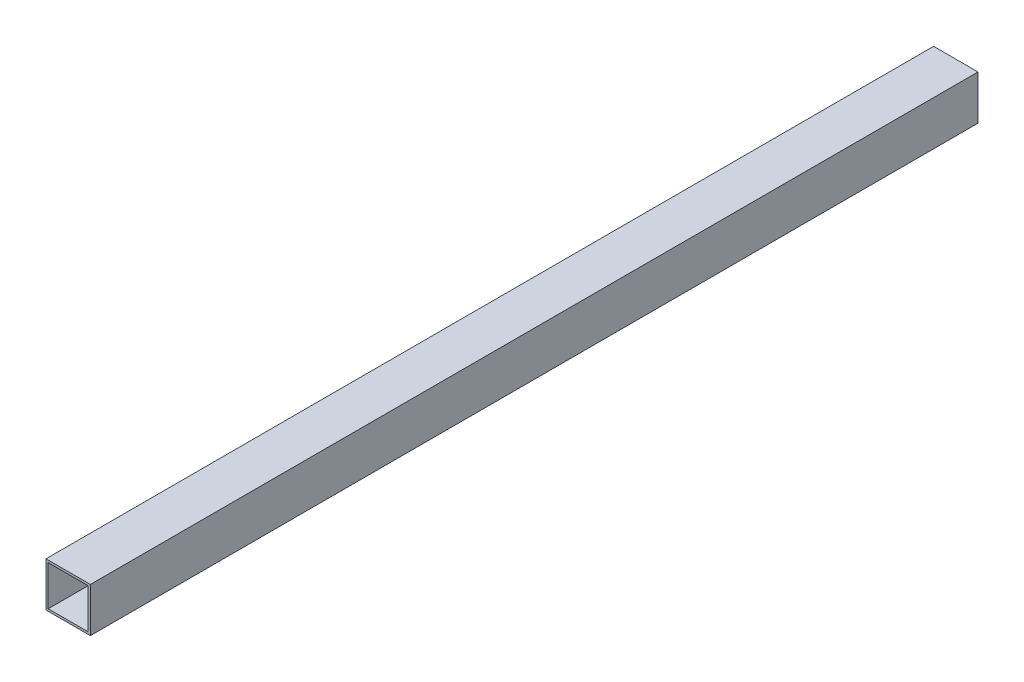
from build123d import *

# Parameters (mm, degrees)
CROQUIS1_W            = 40
CROQUIS1_H            = 40
CROQUIS1_W_2          = 36
CROQUIS1_H_2          = 36
EXTRUIR_L_MINA1_DEPTH = 800


with BuildPart() as part:
    # Croquis1 → Extruir-Lámina1 (new body)
    with BuildSketch(Plane.XY):
        Rectangle(CROQUIS1_W, CROQUIS1_H)
        Rectangle(CROQUIS1_W_2, CROQUIS1_H_2, mode=Mode.SUBTRACT)
    extrude(amount=EXTRUIR_L_MINA1_DEPTH)


solid = part.part
